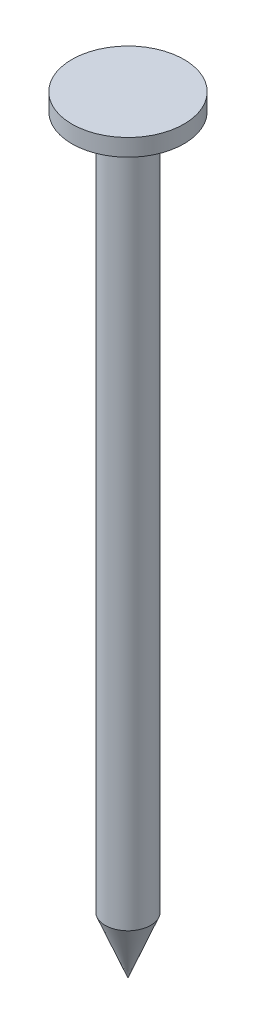
from build123d import *

# Parameters (mm, degrees)
SKETCH1_R           = 0.6
BOSS_EXTRUDE1_DEPTH = 18.25
SKETCH2_R           = 1.475
BOSS_EXTRUDE2_DEPTH = 0.45


with BuildPart() as part:
    # Sketch1 → Boss-Extrude1 (new body)
    with BuildSketch(Plane(origin=(0, 0, 0), x_dir=(1, 0, 0), z_dir=(0, 1, 0))):
        with Locations(Location((0, 0, 0), (0, 0, 270))):
            Circle(SKETCH1_R)
    extrude(amount=BOSS_EXTRUDE1_DEPTH)

    # Sketch2 → Boss-Extrude2 (add)
    with BuildSketch(Plane(origin=(0, 18.25, 0), x_dir=(1, 0, 0), z_dir=(0, 1, 0))):
        with Locations(Location((0, 0, 0), (0, 0, 270))):
            Circle(SKETCH2_R)
    extrude(amount=BOSS_EXTRUDE2_DEPTH)

    # Sketch4 → Revolve1 (revolve)
    with BuildSketch(Plane(origin=(0, 0, 0), x_dir=(0, 0, -1), z_dir=(1, 0, 0)), mode=Mode.PRIVATE) as revolve1_sk:
        Polygon((0, 0), (0, -1.5), (0.6, 0), align=None)
    revolve(revolve1_sk.sketch.rotate(Axis((0, 0, 0), (0, -1, 0)), 180), axis=Axis((0, 0, 0), (0, -1, 0)))


solid = part.part
